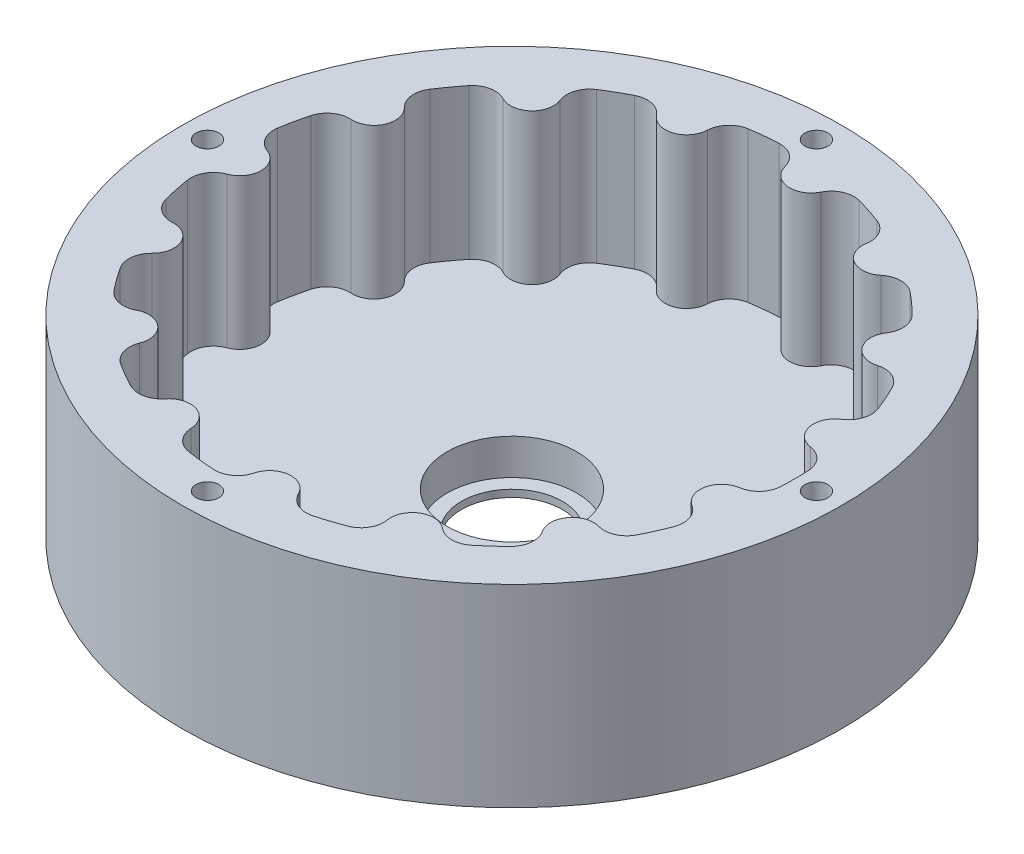
from build123d import *

# Parameters (mm, degrees)
SKETCH1_R            = 46
BOSS_EXTRUDE1_DEPTH  = 27
SKETCH1_3_R          = 46
BOSS_EXTRUDE2_DEPTH  = 6
SKETCH2_R            = 7.05
CUT_EXTRUDE1_DEPTH   = 71.434366612
CUT_EXTRUDE2_START   = 1
SKETCH2_3_R          = 9.05
SKETCH2_3_R_2        = 7.05
CUT_EXTRUDE2_DEPTH   = 70.434366612
M3_CLEARANCE_HOLE1_D = 3.2
CIRPATTERN1_COUNT    = 4


with BuildPart() as part:
    # Sketch1 → Boss-Extrude1 (new body)
    with BuildSketch(Plane(origin=(0, 0, 0), x_dir=(1, 0, 0), z_dir=(0, 1, 0))):
        Circle(SKETCH1_R)
        with BuildLine():
            ThreePointArc((-38.994571123, -6.298684221), (-38.602185265, -4.191732911), (-36.960419774, -2.814120281))
            ThreePointArc((-36.960419774, -2.814120281), (-35, 0), (-36.960419774, 2.814120281))
            ThreePointArc((-36.960419774, 2.814120281), (-38.602185265, 4.191732911), (-38.994571123, 6.298684221))
            ThreePointArc((-38.994571123, 6.298684221), (-38.827494163, 7.257802493), (-38.636830229, 8.212511787))
            ThreePointArc((-38.636830229, 8.212511787), (-38.422695146, 9.162232135), (-38.185218998, 10.106386598))
            ThreePointArc((-38.185218998, 10.106386598), (-36.969782377, 11.87158469), (-34.909629433, 12.462330266))
            ThreePointArc((-34.909629433, 12.462330266), (-31.974091017, 14.235782508), (-32.620417761, 17.603983865))
            ThreePointArc((-32.620417761, 17.603983865), (-33.559919631, 19.53026181), (-33.061407647, 21.614655316))
            ThreePointArc((-33.061407647, 21.614655316), (-32.518666702, 22.422897135), (-31.956171278, 23.217517466))
            ThreePointArc((-31.956171278, 23.217517466), (-31.37426308, 23.99803359), (-30.773295606, 24.76397136))
            ThreePointArc((-30.773295606, 24.76397136), (-28.944968255, 25.882197447), (-26.82264702, 25.583930693))
            ThreePointArc((-26.82264702, 25.583930693), (-23.419571223, 26.010068892), (-22.64004917, 29.349958712))
            ThreePointArc((-22.64004917, 29.349958712), (-22.714839011, 31.491831016), (-21.411626434, 33.193256144))
            ThreePointArc((-21.411626434, 33.193256144), (-20.587066345, 33.710869157), (-19.75, 34.208003449))
            ThreePointArc((-19.75, 34.208003449), (-18.900935901, 34.684357023), (-18.040389838, 35.139640501))
            ThreePointArc((-18.040389838, 35.139640501), (-15.915306166, 35.417543134), (-14.09778526, 34.28183708))
            ThreePointArc((-14.09778526, 34.28183708), (-10.815594803, 33.28697807), (-8.745010399, 36.021059062))
            ThreePointArc((-8.745010399, 36.021059062), (-7.942156368, 38.008176545), (-6.059580493, 39.032441433))
            ThreePointArc((-6.059580493, 39.032441433), (-5.09577519, 39.169925647), (-4.128874299, 39.283614867))
            ThreePointArc((-4.128874299, 39.283614867), (-3.159465195, 39.373440029), (-2.188136774, 39.439346565))
            ThreePointArc((-2.188136774, 39.439346565), (-0.133743055, 38.828873854), (1.064711645, 37.052102396))
            ThreePointArc((1.064711645, 37.052102396), (3.658496214, 34.808266338), (6.662120116, 36.463791059))
            ThreePointArc((6.662120116, 36.463791059), (8.203797264, 37.952563055), (10.340221965, 38.122563))
            ThreePointArc((10.340221965, 38.122563), (11.276621789, 37.856146146), (12.206171278, 37.566732394))
            ThreePointArc((12.206171278, 37.566732394), (13.128305747, 37.254497557), (14.042465016, 36.919631313))
            ThreePointArc((14.042465016, 36.919631313), (15.670945446, 35.526339536), (16.043110235, 33.415722599))
            ThreePointArc((16.043110235, 33.415722599), (17.5, 30.310889132), (20.917309539, 30.601602319))
            ThreePointArc((20.917309539, 30.601602319), (22.931239819, 31.334606626), (24.952106107, 30.620947092))
            ThreePointArc((24.952106107, 30.620947092), (25.699188416, 29.996695064), (26.430658951, 29.354220606))
            ThreePointArc((26.430658951, 29.354220606), (27.146073357, 28.693914011), (27.844997033, 28.016176403))
            ThreePointArc((27.844997033, 28.016176403), (28.765985113, 26.080978366), (28.247509317, 24.001460793))
            ThreePointArc((28.247509317, 24.001460793), (28.315594803, 20.57248383), (31.555706116, 19.448118531))
            ThreePointArc((31.555706116, 19.448118531), (33.693662686, 19.298612044), (35.249544421, 17.824691249))
            ThreePointArc((35.249544421, 17.824691249), (35.678131896, 16.950542893), (36.085045577, 16.066097401))
            ThreePointArc((36.085045577, 16.066097401), (36.47003827, 15.171892057), (36.8328761, 14.268470073))
            ThreePointArc((36.8328761, 14.268470073), (36.887124623, 12.125979097), (35.567657418, 10.437128369))
            ThreePointArc((35.567657418, 10.437128369), (34.235166026, 7.276909179), (36.73783443, 4.931878368))
            ThreePointArc((36.73783443, 4.931878368), (38.630145177, 3.925712118), (39.452016272, 1.946384357))
            ThreePointArc((39.452016272, 1.946384357), (39.488002246, 0.973487866), (39.5, 0))
            ThreePointArc((39.5, 0), (39.488002246, -0.973487866), (39.452016272, -1.946384357))
            ThreePointArc((39.452016272, -1.946384357), (38.630145177, -3.925712118), (36.73783443, -4.931878368))
            ThreePointArc((36.73783443, -4.931878368), (34.235166026, -7.276909179), (35.567657418, -10.437128369))
            ThreePointArc((35.567657418, -10.437128369), (36.887124623, -12.125979097), (36.8328761, -14.268470073))
            ThreePointArc((36.8328761, -14.268470073), (36.47003827, -15.171892057), (36.085045577, -16.066097401))
            ThreePointArc((36.085045577, -16.066097401), (35.678131896, -16.950542893), (35.249544421, -17.824691249))
            ThreePointArc((35.249544421, -17.824691249), (33.693662686, -19.298612044), (31.555706116, -19.448118531))
            ThreePointArc((31.555706116, -19.448118531), (28.315594803, -20.57248383), (28.247509317, -24.001460793))
            ThreePointArc((28.247509317, -24.001460793), (28.765985113, -26.080978366), (27.844997033, -28.016176403))
            ThreePointArc((27.844997033, -28.016176403), (27.146073357, -28.693914011), (26.430658951, -29.354220606))
            ThreePointArc((26.430658951, -29.354220606), (25.699188416, -29.996695064), (24.952106107, -30.620947092))
            ThreePointArc((24.952106107, -30.620947092), (22.931239819, -31.334606626), (20.917309539, -30.601602319))
            ThreePointArc((20.917309539, -30.601602319), (17.5, -30.310889132), (16.043110235, -33.415722599))
            ThreePointArc((16.043110235, -33.415722599), (15.670945446, -35.526339536), (14.042465016, -36.919631313))
            ThreePointArc((14.042465016, -36.919631313), (13.128305747, -37.254497557), (12.206171278, -37.566732394))
            ThreePointArc((12.206171278, -37.566732394), (11.276621789, -37.856146146), (10.340221965, -38.122563))
            ThreePointArc((10.340221965, -38.122563), (8.203797264, -37.952563055), (6.662120116, -36.463791059))
            ThreePointArc((6.662120116, -36.463791059), (3.658496214, -34.808266338), (1.064711645, -37.052102396))
            ThreePointArc((1.064711645, -37.052102396), (-0.133743055, -38.828873854), (-2.188136774, -39.439346565))
            ThreePointArc((-2.188136774, -39.439346565), (-3.159465195, -39.373440029), (-4.128874299, -39.283614867))
            ThreePointArc((-4.128874299, -39.283614867), (-5.09577519, -39.169925647), (-6.059580493, -39.032441433))
            ThreePointArc((-6.059580493, -39.032441433), (-7.942156368, -38.008176545), (-8.745010399, -36.021059062))
            ThreePointArc((-8.745010399, -36.021059062), (-10.815594803, -33.28697807), (-14.09778526, -34.28183708))
            ThreePointArc((-14.09778526, -34.28183708), (-15.915306166, -35.417543134), (-18.040389838, -35.139640501))
            ThreePointArc((-18.040389838, -35.139640501), (-18.900935901, -34.684357023), (-19.75, -34.208003449))
            ThreePointArc((-19.75, -34.208003449), (-20.587066345, -33.710869157), (-21.411626434, -33.193256144))
            ThreePointArc((-21.411626434, -33.193256144), (-22.714839011, -31.491831016), (-22.64004917, -29.349958712))
            ThreePointArc((-22.64004917, -29.349958712), (-23.419571223, -26.010068892), (-26.82264702, -25.583930693))
            ThreePointArc((-26.82264702, -25.583930693), (-28.944968255, -25.882197447), (-30.773295606, -24.76397136))
            ThreePointArc((-30.773295606, -24.76397136), (-31.37426308, -23.99803359), (-31.956171278, -23.217517466))
            ThreePointArc((-31.956171278, -23.217517466), (-32.518666702, -22.422897135), (-33.061407647, -21.614655316))
            ThreePointArc((-33.061407647, -21.614655316), (-33.559919631, -19.53026181), (-32.620417761, -17.603983865))
            ThreePointArc((-32.620417761, -17.603983865), (-31.974091017, -14.235782508), (-34.909629433, -12.462330266))
            ThreePointArc((-34.909629433, -12.462330266), (-36.969782377, -11.87158469), (-38.185218998, -10.106386598))
            ThreePointArc((-38.185218998, -10.106386598), (-38.422695146, -9.162232135), (-38.636830229, -8.212511787))
            ThreePointArc((-38.636830229, -8.212511787), (-38.827494163, -7.257802493), (-38.994571123, -6.298684221))
        make_face(mode=Mode.SUBTRACT)
    extrude(amount=BOSS_EXTRUDE1_DEPTH)

    # Sketch1<3> → Boss-Extrude2 (add)
    with BuildSketch(Plane(origin=(0, 0, 0), x_dir=(1, 0, 0), z_dir=(0, 1, 0))):
        Circle(SKETCH1_3_R)
    extrude(amount=BOSS_EXTRUDE2_DEPTH)

    # Sketch2 → Cut-Extrude1 (cut, through all)
    with BuildSketch(Plane(origin=(0, 0, 0), x_dir=(1, 0, 0), z_dir=(0, 1, 0))):
        Circle(SKETCH2_R)
    extrude(amount=CUT_EXTRUDE1_DEPTH, mode=Mode.SUBTRACT)

    # Sketch2<3> → Cut-Extrude2 (cut, through all)
    with BuildSketch(Plane(origin=(0, 0, 0), x_dir=(1, 0, 0), z_dir=(0, 1, 0)).offset(CUT_EXTRUDE2_START)):
        Circle(SKETCH2_3_R)
        Circle(SKETCH2_3_R_2, mode=Mode.SUBTRACT)
    extrude(amount=CUT_EXTRUDE2_DEPTH, mode=Mode.SUBTRACT)

    # M3 Clearance Hole1 (through all)
    with Locations(Plane(origin=(0, 27, 0), x_dir=(1, 0, 0), z_dir=(0, 1, 0))):
        with Locations((-42.5, 0)):
            m3_clearance_hole1 = Hole(M3_CLEARANCE_HOLE1_D / 2)

    # CirPattern1: M3 Clearance Hole1 ×4 about axis
    cirpattern1_axis = Axis((0, 27, 0), (0, -1, 0))
    for i in range(1, CIRPATTERN1_COUNT):
        add(m3_clearance_hole1.rotate(cirpattern1_axis, i * 360 / CIRPATTERN1_COUNT), mode=Mode.SUBTRACT)


solid = part.part
